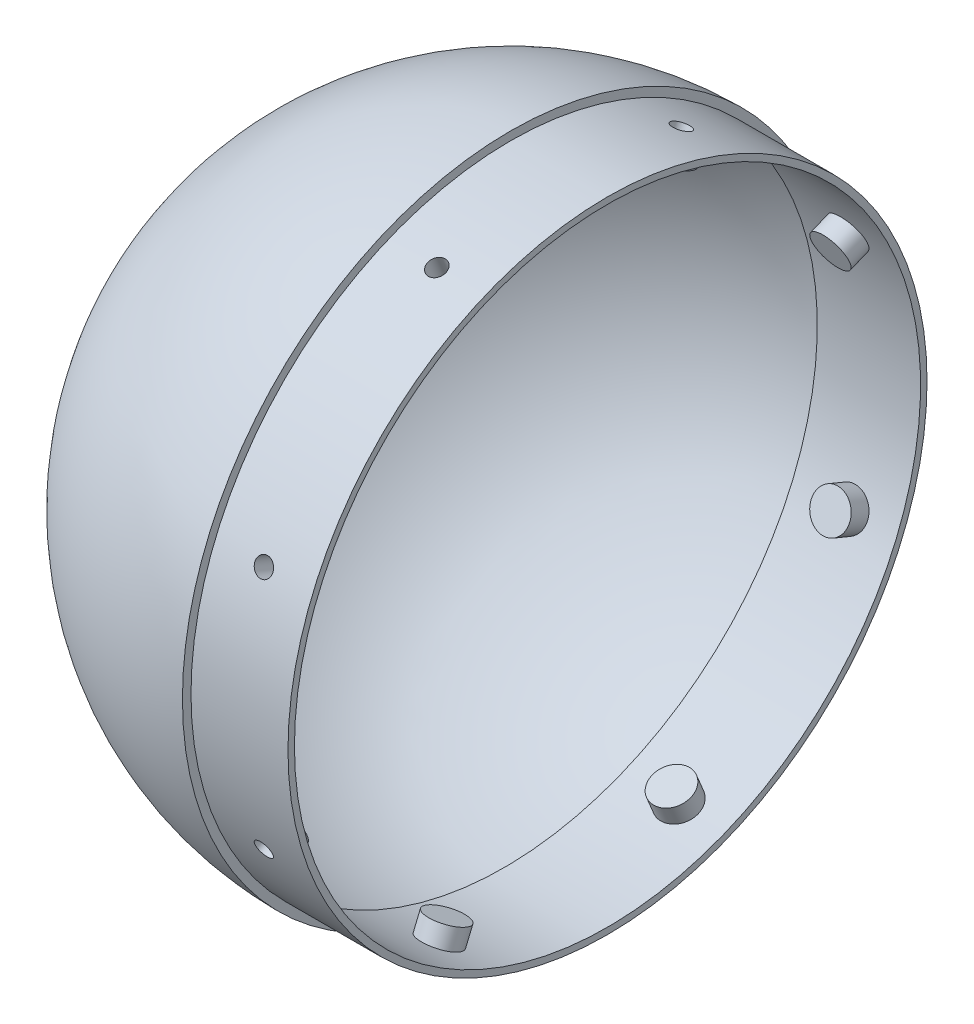
from build123d import *

# Parameters (mm, degrees)
BOSS_START                = -91
BOSS_SKETCH_R             = 6
BOSS_DEPTH                = 6.5
INSERT_START              = -92
INSERT_HOLE_SKETCH_R      = 2.8
INSERT_HOLE_DEPTH         = 8
BOSSES_AND_HOLES_X8_COUNT = 8


with BuildPart() as part:
    # Dome Sketch → Dome (revolve)
    with BuildSketch(Plane.XY):
        with BuildLine():
            Line((30, 97), (30, 99))
            Line((30, 99), (-0.05, 99))
            Line((-0.05, 99), (-0.05, 101.649987703))
            ThreePointArc((-0.05, 101.649987703), (-71.895079804, 71.859724464), (-101.65, 0))
            Line((-101.65, 0), (-99.65, 0))
            ThreePointArc((-99.65, 0), (-71.166784738, 69.752499955), (-2, 99.629927733))
            Line((-2, 99.629927733), (-2, 97))
            Line((-2, 97), (30, 97))
        make_face()
    revolve(axis=Axis((-200, 0, 0), (1, 0, 0)))

    # Boss Sketch → Boss (add)
    with BuildSketch(Plane(origin=(0, 0, 0), x_dir=(-1, 0, 0), z_dir=(0, -0.9238795325112867, -0.3826834323650897)).offset(BOSS_START)):
        with Locations((-15, 0)):
            Circle(BOSS_SKETCH_R)
    boss = extrude(amount=-BOSS_DEPTH)

    # Insert Hole Sketch → Insert Hole (cut)
    with BuildSketch(Plane(origin=(0, 0, 0), x_dir=(-1, 0, 0), z_dir=(0, -0.9238795325112867, -0.3826834323650897)).offset(INSERT_START)):
        with Locations((-15, 0)):
            Circle(INSERT_HOLE_SKETCH_R)
    insert_hole = extrude(amount=-INSERT_HOLE_DEPTH, mode=Mode.SUBTRACT)

    # Bosses and Holes x8: Boss, Insert Hole ×8 about axis
    bosses_and_holes_x8_axis = Axis((36.5825, 0, 0), (-1, 0, 0))
    add([boss.rotate(bosses_and_holes_x8_axis, i * 360 / BOSSES_AND_HOLES_X8_COUNT) for i in range(1, BOSSES_AND_HOLES_X8_COUNT)])
    add([insert_hole.rotate(bosses_and_holes_x8_axis, i * 360 / BOSSES_AND_HOLES_X8_COUNT) for i in range(1, BOSSES_AND_HOLES_X8_COUNT)], mode=Mode.SUBTRACT)


solid = part.part
